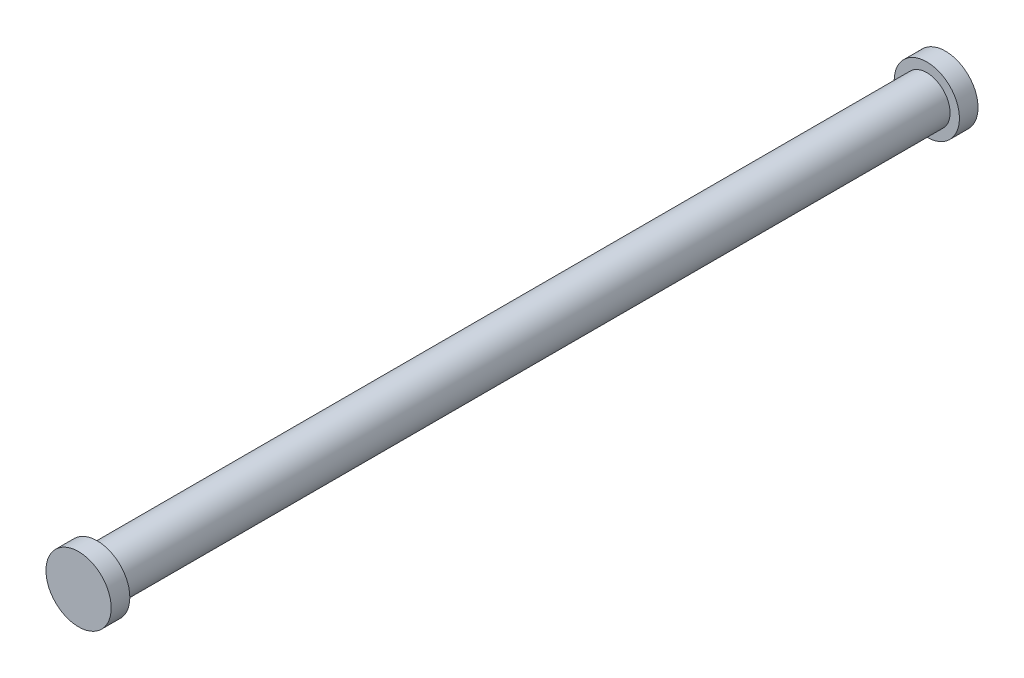
from build123d import *

# Parameters (mm, degrees)
SKETCH1_R           = 2.5
BOSS_EXTRUDE1_DEPTH = 89
SKETCH2_R           = 3.5
BOSS_EXTRUDE2_DEPTH = 2
BOSS_EXTRUDE3_START = 2
SKETCH3_R           = 3.5
BOSS_EXTRUDE3_DEPTH = 2


with BuildPart() as part:
    # Sketch1 → Boss-Extrude1 (new body)
    with BuildSketch(Plane.XY):
        Circle(SKETCH1_R)
    extrude(amount=BOSS_EXTRUDE1_DEPTH)

    # Sketch2 → Boss-Extrude2 (add)
    with BuildSketch(Plane(origin=(0, 0, 0), x_dir=(-1, 0, 0), z_dir=(0, 0, -1))):
        Circle(SKETCH2_R)
    extrude(amount=BOSS_EXTRUDE2_DEPTH)

    # Sketch3 → Boss-Extrude3 (add)
    with BuildSketch(Plane.XY.offset(89).offset(BOSS_EXTRUDE3_START)):
        with Locations(Location((0, 0, 0), (0, 0, 180))):
            Circle(SKETCH3_R)
    extrude(amount=-BOSS_EXTRUDE3_DEPTH)


solid = part.part
